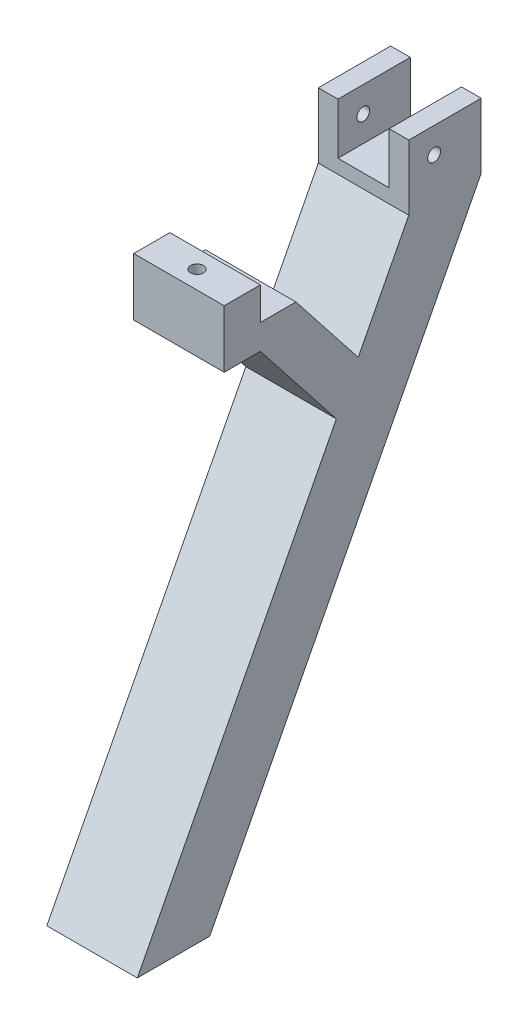
from build123d import *

# Parameters (mm, degrees)
BOSS_EXTRUDE1_DEPTH = 25
SKETCH5_W           = 14.15
SKETCH5_H           = 14.15
CUT_EXTRUDE4_DEPTH  = 346.591241967
CUT_EXTRUDE5_REACH  = 371.537
SKETCH6_R           = 1.775
BOSS_EXTRUDE2_DEPTH = 25
SKETCH9_R           = 1.775
CUT_EXTRUDE6_DEPTH  = 15.926403812


with BuildPart() as part:
    # Sketch1 → Boss-Extrude1 (new body)
    with BuildSketch(Plane(origin=(0, 0, 0), x_dir=(0, 0, -1), z_dir=(1, 0, 0))):
        Polygon((-75.827871616, -173.427267807), (-55.827871616, -173.427267807), (-55.827871616, -191.427267807), (-130.827871616, -336.427267807), (-150.827871616, -336.427267807), (-91.827871616, -222.360601141), (-75.827871616, -191.427267807), align=None)
    extrude(amount=BOSS_EXTRUDE1_DEPTH)

    # Sketch5 → Cut-Extrude4 (cut, through all)
    with BuildSketch(Plane.XY.offset(75.827871616)):
        with Locations((12.5, -180.502267807)):
            Rectangle(SKETCH5_W, SKETCH5_H)
    extrude(amount=-CUT_EXTRUDE4_DEPTH, mode=Mode.SUBTRACT)

    # Cut-Extrude5: up to this face of the body (flat: up to its plane)
    cut_extrude5_end = Plane(part.part.faces().sort_by_distance((0, -254.927267807, 99.186767321))[0])
    # Sketch6 → Cut-Extrude5 (cut, up to the picked face)
    with BuildSketch(Plane(origin=(25, 0, 0), x_dir=(0, 0, -1), z_dir=(1, 0, 0)), mode=Mode.PRIVATE) as cut_extrude5_sk1:
        with Locations((-68.827871616, -180.477267807)):
            Circle(SKETCH6_R)
    cut_extrude5_tool1 = split(extrude(cut_extrude5_sk1.sketch, amount=-CUT_EXTRUDE5_REACH, mode=Mode.PRIVATE), bisect_by=cut_extrude5_end, keep=Keep.BOTH, mode=Mode.PRIVATE)
    add(cut_extrude5_tool1.solids().sort_by(Axis((25, -180.477268, 68.827872), (-1, 0, 0)))[0], mode=Mode.SUBTRACT)

    # Sketch8 → Boss-Extrude2 (add)
    with BuildSketch(Plane(origin=(25, 0, 0), x_dir=(0, 0, -1), z_dir=(1, 0, 0))):
        Polygon((-126.827871616, -187.577267807), (-116.827871616, -187.577267807), (-116.827871616, -196.577267807), (-107.00799507, -196.577267807), (-89.793388857, -218.427267807), (-95.84798887, -230.132827833), (-116.827871616, -203.503671619), (-126.827871616, -203.503671619), (-126.827871616, -196.577267807), align=None)
    extrude(amount=-BOSS_EXTRUDE2_DEPTH)

    # Sketch9 → Cut-Extrude6 (cut)
    with BuildSketch(Plane(origin=(0, -187.577267807, 0), x_dir=(1, 0, 0), z_dir=(0, 1, 0))):
        with Locations(Location((12.5, -121.827871616, 0), (0, 0, 270))):
            Circle(SKETCH9_R)
    extrude(amount=-CUT_EXTRUDE6_DEPTH, mode=Mode.SUBTRACT)


solid = part.part
